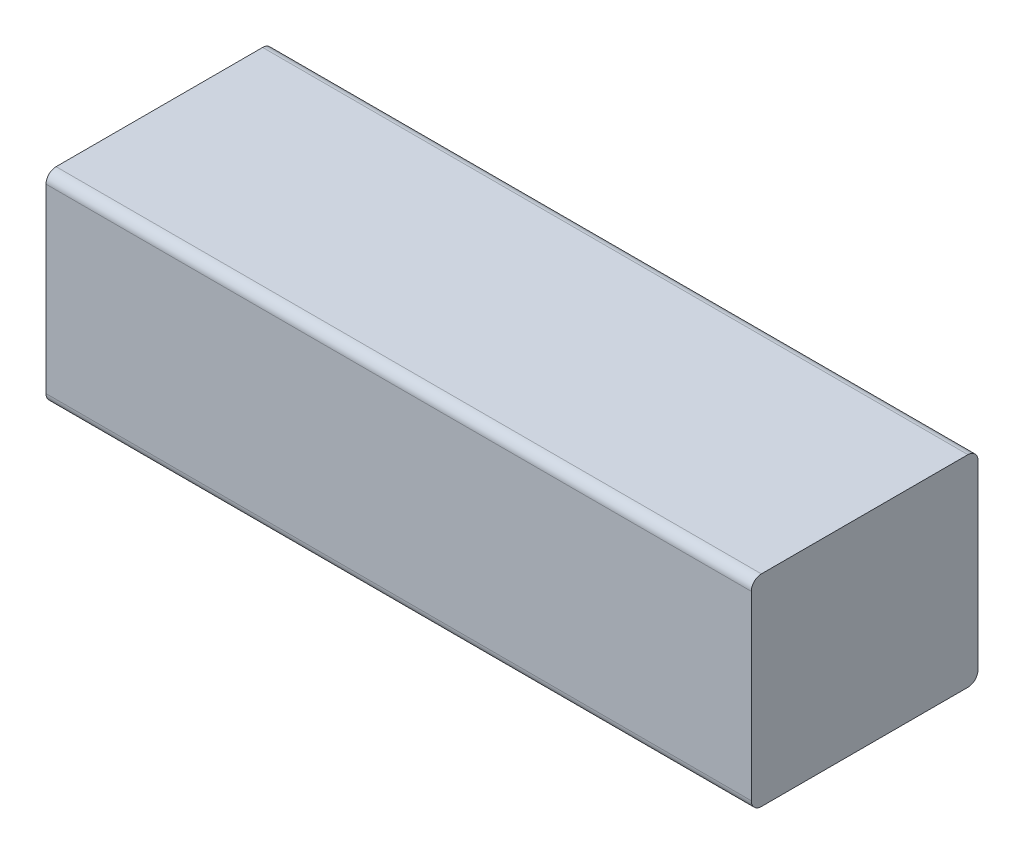
from build123d import *

# Parameters (mm, degrees)
ESQUISSE1_W        = 140
ESQUISSE1_H        = 45
BOSS_EXTRU_1_DEPTH = 40
CONG_1_R           = 2


with BuildPart() as part:
    # Esquisse1 → Boss.-Extru.1 (new body)
    with BuildSketch(Plane(origin=(0, 0, 0), x_dir=(1, 0, 0), z_dir=(0, 1, 0))):
        with Locations((70, 22.5)):
            Rectangle(ESQUISSE1_W, ESQUISSE1_H)
    extrude(amount=BOSS_EXTRU_1_DEPTH)

    # Congé1
    cong_1_edges = [part.edges().sort_by_distance(p)[0] for p in [
        (70, 40, -45),
        (70, 0, -45),
        (70, 0, 0),
        (70, 40, 0),
    ]]
    fillet(cong_1_edges, radius=CONG_1_R)


solid = part.part
